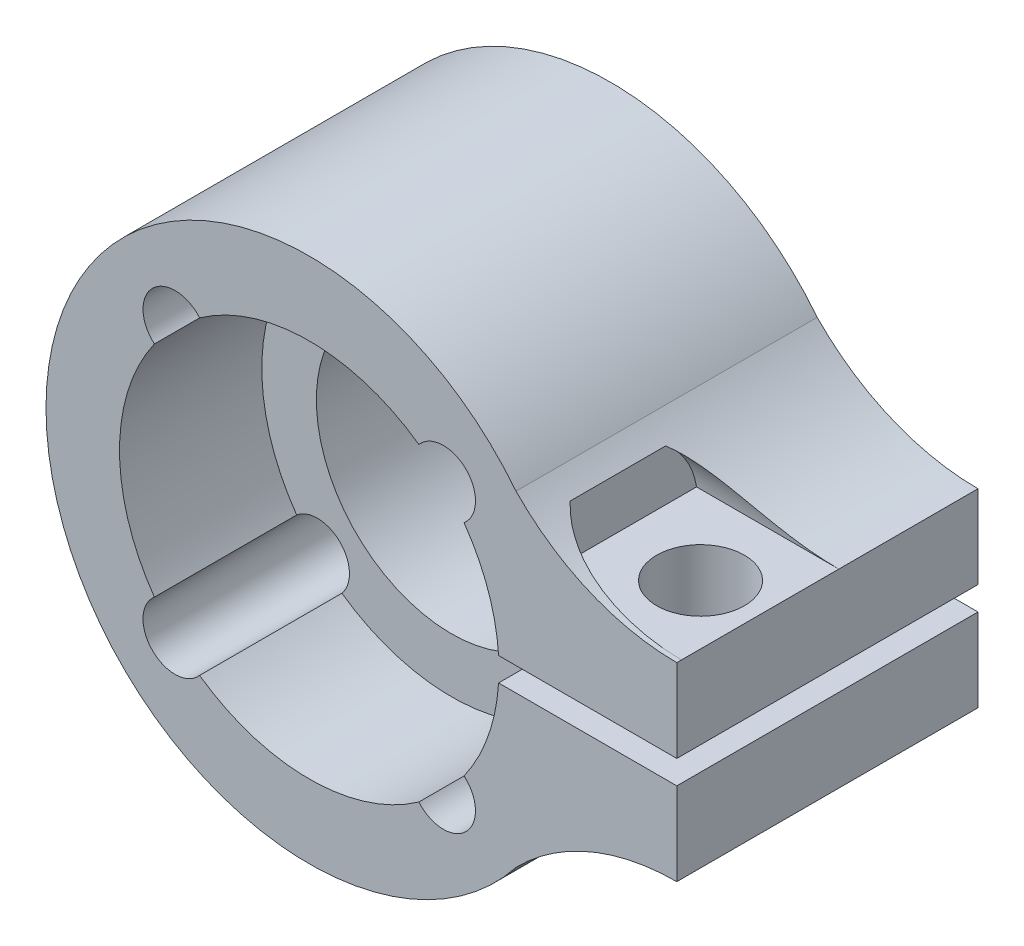
from build123d import *

# Parameters (mm, degrees)
EXTRUDE1_DEPTH            = 12.7
F_6_32_TAPPED_HOLE3_D     = 2.7051
SKETCH14_R                = 1.85
CUT_EXTRUDE6_DEPTH        = 24.153833376
F_6_32_TAPPED_HOLE5_D     = 2.7051
F_6_32_TAPPED_HOLE5_DEPTH = 50.8
F_6_32_TAPPED_HOLE5_TIP   = 0.81269403
CUT_EXTRUDE26_DEPTH       = 6
SKETCH25_R                = 5.7
CUT_EXTRUDE27_DEPTH       = 23.907422501
SKETCH26_R                = 8
CUT_EXTRUDE28_DEPTH       = 6


with BuildPart() as part:
    # Sketch1 → Extrude1 (new body)
    with BuildSketch(Plane.XY):
        with BuildLine():
            Line((0, 0), (0, 0.5))
            Line((0, 0.5), (15.5, 0.5))
            Line((15.5, 0.5), (15.5, 4))
            ThreePointArc((15.5, 4), (11.819050527, 4.746581358), (8.719864541, 6.868330393))
            ThreePointArc((8.719864541, 6.868330393), (-11.1, 0), (8.719864541, -6.868330393))
            ThreePointArc((8.719864541, -6.868330393), (11.819050527, -4.746581358), (15.5, -4))
            Line((15.5, -4), (15.5, -0.5))
            Line((15.5, -0.5), (0, -0.5))
            Line((0, -0.5), (0, 0))
        make_face()
    extrude(amount=-EXTRUDE1_DEPTH)

    # #6-32 Tapped Hole3 (through all)
    with Locations(Plane(origin=(-5.656516225, 5.657192254, 0), x_dir=(1, 0, 0), z_dir=(0, 0, 1))):
        with Locations((0, 0), (11.313708479, -0.000676029), (11.31303245, -11.314384508), (-0.000676029, -11.313708479)):
            Hole(F_6_32_TAPPED_HOLE3_D / 2)

    # Sketch14 → Cut-Extrude6 (cut, through all)
    with BuildSketch(Plane.XZ.offset(-0.5)):
        with Locations(Location((13, -3.5, 0), (0, 0, 270))):
            Circle(SKETCH14_R)
    extrude(amount=-CUT_EXTRUDE6_DEPTH, mode=Mode.SUBTRACT)

    # #6-32 Tapped Hole5
    with Locations(Plane(origin=(0, -0.5, 0), x_dir=(-1, 0, 0), z_dir=(0, 1, 0))):
        with Locations((-13, -3.5)):
            Hole(F_6_32_TAPPED_HOLE5_D / 2, depth=F_6_32_TAPPED_HOLE5_DEPTH)
            with Locations((0, 0, -(F_6_32_TAPPED_HOLE5_DEPTH + F_6_32_TAPPED_HOLE5_TIP / 2))):  # 118° drill point
                Cone(0, F_6_32_TAPPED_HOLE5_D / 2, F_6_32_TAPPED_HOLE5_TIP, mode=Mode.SUBTRACT)

    # Sketch24 → Cut-Extrude26 (cut)
    with BuildSketch(Plane(origin=(15.5, 0, 0), x_dir=(0, 0, -1), z_dir=(1, 0, 0))):
        with BuildLine():
            Line((0.2, 4), (6.832300833, 4))
            ThreePointArc((6.832300833, 4), (3.516150417, 6.820400286), (0.2, 4))
        make_face()
    extrude(amount=-CUT_EXTRUDE26_DEPTH, mode=Mode.SUBTRACT)

    # Sketch25 → Cut-Extrude27 (cut, through all)
    with BuildSketch(Plane.XY):
        Circle(SKETCH25_R)
    extrude(amount=-CUT_EXTRUDE27_DEPTH, mode=Mode.SUBTRACT)

    # Sketch26 → Cut-Extrude28 (cut)
    with BuildSketch(Plane.XY):
        Circle(SKETCH26_R)
    extrude(amount=-CUT_EXTRUDE28_DEPTH, mode=Mode.SUBTRACT)


solid = part.part
